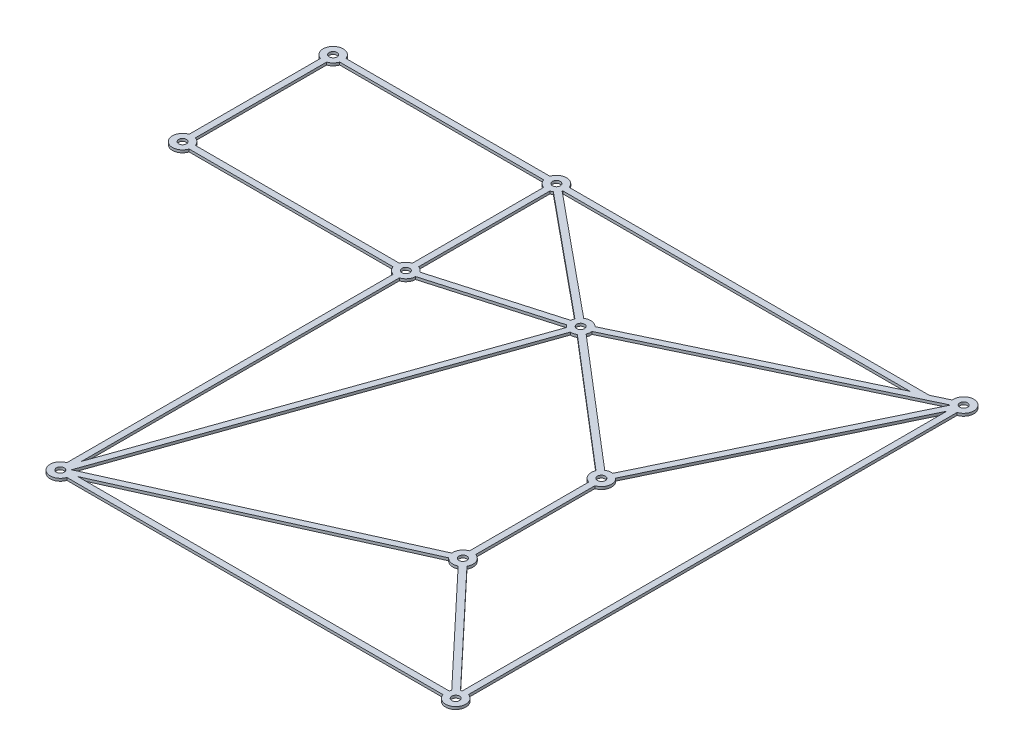
from build123d import *

# Parameters (mm, degrees)
SKETCH1_R           = 1.5000000000001341
SKETCH1_R_2         = 1.5000000000000266
SKETCH1_R_3         = 1.4999999999999927
SKETCH1_R_4         = 1.5000000000003626
SKETCH1_R_5         = 1.4999999999999407
SKETCH1_R_6         = 1.500000000000151
BOSS_EXTRUDE1_DEPTH = 20
SKETCH2_R           = 1.500000000000026
SKETCH2_R_2         = 1.5000000000000242
SKETCH2_R_3         = 1.5000000000000282
SKETCH2_R_4         = 1.4999999999999991
BOSS_EXTRUDE2_DEPTH = 4.8
SKETCH3_R           = 1.4999999999999336
SKETCH3_R_2         = 1.5000000000000355
SKETCH3_R_3         = 1.500000000000057
BOSS_EXTRUDE3_DEPTH = 5
SKETCH4_R           = 1.5000000000000266
CUT_EXTRUDE1_DEPTH  = 251.6301657821741
SKETCH5_R           = 1.5000000000000258
SKETCH5_R_2         = 1.500000000000026
SKETCH5_R_3         = 1.5000000000000289
BOSS_EXTRUDE4_DEPTH = 4.7
CUT_EXTRUDE2_START  = -1
CUT_EXTRUDE2_DEPTH  = 251.07465025366474


with BuildPart() as part:
    # Sketch1 → Boss-Extrude1 (new body)
    with BuildSketch(Plane(origin=(0, 0, 0), x_dir=(1, 0, 0), z_dir=(0, 1, 0))):
        with BuildLine():
            ThreePointArc((153.5, 0.854204936944094), (154.38321422631046, 7.862001438777041), (148.43342016008168, 4.0555293516432975))
            Line((148.4334201600817, 4.05552935164329), (55.136136135840104, -40.297999473481156))
            ThreePointArc((55.136136135840104, -40.297999473481205), (49.4022066675553, -40.36486709103945), (49.9330012537212, -46.07456721738933))
            Line((49.93300125372118, -46.07456721738933), (0.10392068340978255, -187.20138479821878))
            ThreePointArc((0.10392068340981986, -187.2013847982188), (-3.183862952537658, -193.35233583185502), (3.7107950630558904, -192.30000000000007))
            Line((3.7107950630558797, -192.30000000000007), (148.58920493694413, -192.30000000000004))
            ThreePointArc((148.58920493694416, -192.29999999999998), (155.05771644662758, -193.8577164466275), (153.5, -187.38920493694408))
            Line((153.5, -187.38920493694408), (153.50000000000006, 0.8542049369440861))
        make_face()
        with Locations(Location((-8.848e-14, -191.1000000000001, 0), (0, 0, 270))):
            Circle(SKETCH1_R, mode=Mode.SUBTRACT)
        with BuildLine():
            ThreePointArc((103.3728036004878, -88.15255576252058), (103.43263144023695, -91.28238466086896), (105.77419999999994, -93.35999506305585))
            Line((105.77420000000004, -93.35999506305582), (105.77420000000004, -139.26420493694414))
            ThreePointArc((105.77419999999995, -139.26420493694414), (103.6992799358026, -140.85724208817035), (103.09776398625954, -143.4030698907605))
            Line((103.09776398625954, -143.4030698907605), (2.065248361956577, -188.85505564451773))
            Line((2.065248361956572, -188.85505564451773), (52.196079316590236, -46.87361520178129))
            ThreePointArc((52.19607931659019, -46.873615201781234), (53.3115705172937, -46.74152692656541), (54.34314539722364, -46.296980867766095))
            Line((54.34314539722364, -46.296980867766095), (103.3728036004877, -88.15255576252065))
        make_face(mode=Mode.SUBTRACT)
        with BuildLine():
            ThreePointArc((104.08241137935872, -145.59178401354208), (106.21355041942587, -146.8001029026122), (108.64483789051103, -146.49905576556174))
            Line((108.64483789051097, -146.49905576556182), (148.88225626835828, -189.22142932397452))
            ThreePointArc((148.88225626835816, -189.22142932397455), (148.7196186128475, -189.5537564478609), (148.58920493694413, -189.90000000000006))
            Line((148.5892049369441, -189.9), (5.592313538765211, -189.9))
            Line((5.5923135387652225, -189.9), (104.08241137935869, -145.59178401354194))
        make_face(mode=Mode.SUBTRACT)
        with Locations(Location((106.97420000000002, -142.975, 0), (0, 0, 270))):
            Circle(SKETCH1_R_2, mode=Mode.SUBTRACT)
        with Locations(Location((152.3, -191.09999999999997, 0), (0, 0, 270))):
            Circle(SKETCH1_R_3, mode=Mode.SUBTRACT)
        with BuildLine():
            Line((108.17420000000006, -139.26420493694408), (108.17420000000006, -93.35999506305589))
            ThreePointArc((108.17420000000001, -93.35999506305588), (110.7765884274194, -90.51628837325106), (109.66431253714993, -86.82549772506573))
            Line((109.66431253715001, -86.82549772506573), (151.10000000000005, -0.6972849684802185))
            Line((151.10000000000005, -0.6972849684802256), (151.09999999999997, -187.38920493694414))
            ThreePointArc((151.09999999999997, -187.38920493694414), (150.861647342994, -187.47492874082678), (150.62936210948922, -187.57594423443817))
            Line((150.62936210948916, -187.57594423443825), (110.3919437316418, -144.85357067602544))
            ThreePointArc((110.39194373164192, -144.85357067602538), (110.5992712591732, -141.53664734299386), (108.17420000000001, -139.2642049369441))
        make_face(mode=Mode.SUBTRACT)
        with Locations(Location((52.29999999999968, -42.97500000000005, 0), (0, 0, 270))):
            Circle(SKETCH1_R_4, mode=Mode.SUBTRACT)
        with Locations(Location((106.9742, -89.6491999999999, 0), (0, 0, 270))):
            Circle(SKETCH1_R_5, mode=Mode.SUBTRACT)
        with BuildLine():
            Line((149.6098874628501, 1.7412977250657464), (107.501580307415, -85.78502220759042))
            ThreePointArc((107.50158030741511, -85.78502220759047), (106.16928986331158, -85.83316545195719), (104.93105460277636, -86.32721913223392))
            Line((104.93105460277634, -86.32721913223394), (55.901396399512244, -44.47164423747948))
            ThreePointArc((55.90139639951222, -44.471644237479474), (56.16636670686683, -43.48608559755858), (56.16657983991836, -42.46552935164333))
            Line((56.166579839918334, -42.4655293516433), (149.46386386415992, 1.8879994734811447))
            ThreePointArc((149.46386386415995, 1.887999473481198), (149.53590223586832, 1.8136796714446448), (149.6098874628501, 1.7412977250657597))
        make_face(mode=Mode.SUBTRACT)
        with Locations(Location((152.3000000000001, 4.5650000000001185, 0), (0, 0, 270))):
            Circle(SKETCH1_R_6, mode=Mode.SUBTRACT)
    extrude(amount=BOSS_EXTRUDE1_DEPTH)

    # Sketch2 → Boss-Extrude2 (add)
    # profile 1 of 8: a face of its own
    with BuildSketch(Plane(origin=(0, 20, 0), x_dir=(1, 0, 0), z_dir=(0, 1, 0))):
        with BuildLine():
            ThreePointArc((151.10000000000005, -187.3892049369441), (152.30000000000004, -187.2), (153.50000000000006, -187.3892049369441))
            Line((153.50000000000006, -187.3892049369441), (153.50000000000006, 0.8542049369441145))
            ThreePointArc((153.50000000000006, 0.854204936944114), (152.30000000000007, 0.6650000000000027), (151.10000000000008, 0.8542049369440972))
            Line((151.10000000000008, 0.8542049369441145), (151.10000000000008, -0.6972849684802327))
            Line((151.10000000000008, -0.6972849684802327), (151.10000000000005, -187.3892049369441))
        make_face()
    # profile 2 of 8: a face of its own
    with BuildSketch(Plane(origin=(0, 20, 0), x_dir=(1, 0, 0), z_dir=(0, 1, 0))):
        with BuildLine():
            ThreePointArc((151.10000000000008, 0.8542049369440972), (152.30000000000007, 0.6650000000000027), (153.50000000000006, 0.854204936944114))
            ThreePointArc((153.50000000000006, 0.8542049369441145), (155.45356940624433, 2.2704412188832563), (156.20000000000005, 4.5649999999999995))
            ThreePointArc((156.20000000000005, 4.5649999999999995), (152.04471719180643, 8.456635991179125), (148.4334201600817, 4.055529351643286))
            ThreePointArc((148.4334201600817, 4.055529351643285), (148.7777639479866, 2.890528980872804), (149.46386386415998, 1.887999473481146))
            ThreePointArc((149.46386386416, 1.8879994734811634), (149.53590223586832, 1.813679671444651), (149.60988746285008, 1.7412977250658015))
            ThreePointArc((149.60988746285008, 1.7412977250657988), (150.30501195702655, 1.2138773957981126), (151.10000000000008, 0.8542049369440972))
        make_face()
        with Locations(Location((152.30000000000004, 4.5649999999999995, 0), (0, 0, 270))):
            Circle(SKETCH2_R, mode=Mode.SUBTRACT)
    # profile 3 of 8: a face of its own
    with BuildSketch(Plane(origin=(0, 20, 0), x_dir=(1, 0, 0), z_dir=(0, 1, 0))):
        with BuildLine():
            ThreePointArc((156.20000000000005, -191.1), (155.45356940624436, -188.80544121888326), (153.50000000000006, -187.3892049369441))
            ThreePointArc((153.50000000000006, -187.3892049369441), (152.30000000000004, -187.2), (151.10000000000005, -187.3892049369441))
            ThreePointArc((151.10000000000005, -187.3892049369441), (150.861647342994, -187.47492874082678), (150.62936210948916, -187.5759442344382))
            ThreePointArc((150.62936210948916, -187.5759442344382), (149.62608672950364, -188.2609530081622), (148.88225626835825, -189.22142932397443))
            ThreePointArc((148.88225626835825, -189.22142932397443), (148.71961861284757, -189.55375644786082), (148.58920493694416, -189.9))
            ThreePointArc((148.58920493694416, -189.9), (148.40000000000003, -191.10000000000002), (148.58920493694416, -192.30000000000004))
            ThreePointArc((148.58920493694416, -192.30000000000004), (152.90741223813905, -194.95240838605656), (156.20000000000005, -191.1))
        make_face()
        with Locations(Location((152.30000000000004, -191.1, 0), (0, 0, 270))):
            Circle(SKETCH2_R_2, mode=Mode.SUBTRACT)
    # profile 4 of 8: a face of its own
    with BuildSketch(Plane(origin=(0, 20, 0), x_dir=(1, 0, 0), z_dir=(0, 1, 0))):
        with BuildLine():
            ThreePointArc((108.17420000000006, -93.35999506305586), (106.97420000000004, -93.54919999999997), (105.77420000000002, -93.35999506305588))
            Line((105.77420000000004, -93.35999506305588), (105.77420000000004, -139.2642049369441))
            ThreePointArc((105.77420000000002, -139.2642049369441), (106.97420000000004, -139.075), (108.17420000000006, -139.2642049369441))
            Line((108.17420000000006, -139.2642049369441), (108.17420000000006, -93.35999506305586))
        make_face()
    # profile 5 of 8: a face of its own
    with BuildSketch(Plane(origin=(0, 20, 0), x_dir=(1, 0, 0), z_dir=(0, 1, 0))):
        with BuildLine():
            ThreePointArc((108.17420000000006, -139.2642049369441), (106.97420000000004, -139.075), (105.77420000000002, -139.2642049369441))
            ThreePointArc((105.77420000000002, -139.2642049369441), (103.69927993580262, -140.85724208817032), (103.09776398625954, -143.4030698907605))
            ThreePointArc((103.09776398625954, -143.4030698907605), (103.4175395504801, -144.575052013786), (104.08241137935862, -145.59178401354197))
            ThreePointArc((104.08241137935862, -145.59178401354197), (106.21355041942574, -146.80010290261217), (108.64483789051093, -146.49905576556176))
            ThreePointArc((108.64483789051093, -146.49905576556176), (109.64811327049645, -145.81404699183776), (110.39194373164183, -144.85357067602556))
            ThreePointArc((110.3919437316418, -144.85357067602553), (110.75171244560511, -143.94474209112445), (110.8742, -142.975))
            ThreePointArc((110.8742, -142.975), (110.12776940624433, -140.68044121888326), (108.17420000000006, -139.2642049369441))
        make_face()
        with Locations(Location((106.97420000000002, -142.975, 0), (0, 0, 270))):
            Circle(SKETCH2_R_2, mode=Mode.SUBTRACT)
    # profile 6 of 8: a face of its own
    with BuildSketch(Plane(origin=(0, 20, 0), x_dir=(1, 0, 0), z_dir=(0, 1, 0))):
        with BuildLine():
            ThreePointArc((103.37280360048776, -88.15255576252066), (103.43263144023699, -91.28238466086904), (105.77420000000002, -93.35999506305588))
            ThreePointArc((105.77420000000002, -93.35999506305588), (106.97420000000004, -93.54919999999997), (108.17420000000006, -93.35999506305586))
            ThreePointArc((108.17420000000006, -93.35999506305586), (110.12776940624433, -91.94375878111673), (110.87420000000002, -89.64919999999998))
            ThreePointArc((110.87420000000002, -89.64919999999998), (110.55899001441402, -88.11320502847254), (109.66431253714997, -86.82549772506577))
            ThreePointArc((109.66431253714997, -86.82549772506577), (108.6649727158974, -86.13476012668062), (107.50158030741501, -85.78502220759047))
            ThreePointArc((107.50158030741501, -85.78502220759047), (106.16928986331155, -85.8331654519572), (104.93105460277637, -86.32721913223392))
            ThreePointArc((104.93105460277637, -86.32721913223392), (104.00802797578407, -87.117042121281), (103.37280360048776, -88.15255576252066))
        make_face()
        with Locations(Location((106.97420000000002, -89.64919999999998, 0), (0, 0, 270))):
            Circle(SKETCH2_R_3, mode=Mode.SUBTRACT)
    # profile 7 of 8: a face of its own
    with BuildSketch(Plane(origin=(0, 20, 0), x_dir=(1, 0, 0), z_dir=(0, 1, 0))):
        with BuildLine():
            ThreePointArc((3.9000000000000385, -191.10000000000002), (3.639229013163515, -189.69785443346666), (2.8917886206414805, -188.48321598645808))
            Line((2.8917886206414494, -188.48321598645805), (2.0652483619565345, -188.85505564451776))
            Line((2.0652483619565296, -188.85505564451776), (2.3669987462788447, -188.00043278261063))
            ThreePointArc((2.3669987462787443, -188.00043278261063), (1.2984529746368263, -187.42249814783776), (0.10392068340977106, -187.20138479821878))
            ThreePointArc((0.10392068340977109, -187.20138479821878), (-3.1838629525376483, -193.35233583185502), (3.71079506305589, -192.30000000000004))
            ThreePointArc((3.710795063055924, -192.30000000000004), (3.8524083860566067, -191.70741223813903), (3.9000000000000385, -191.10000000000002))
        make_face()
        with Locations(Location((2.776e-14, -191.10000000000002, 0), (0, 0, 270))):
            Circle(SKETCH2_R_4, mode=Mode.SUBTRACT)
    # profile 8 of 8: a face of its own
    with BuildSketch(Plane(origin=(0, 20, 0), x_dir=(1, 0, 0), z_dir=(0, 1, 0))):
        with BuildLine():
            ThreePointArc((49.93300125372118, -46.07456721738931), (51.00154702536313, -46.652501852162246), (52.19607931659024, -46.873615201781234))
            ThreePointArc((52.19607931659024, -46.873615201781234), (53.311570517293724, -46.741526926565406), (54.34314539722362, -46.29698086776611))
            ThreePointArc((54.34314539722362, -46.29698086776611), (55.266172024215926, -45.50715787871904), (55.90139639951226, -44.47164423747939))
            ThreePointArc((55.90139639951226, -44.47164423747939), (56.124620632043, -43.738070783709574), (56.20000000000001, -42.975000000000016))
            ThreePointArc((56.20000000000001, -42.975000000000016), (56.19163599117914, -42.71971719180637), (56.16657983991835, -42.46552935164326))
            ThreePointArc((56.16657983991835, -42.46552935164326), (55.82223605201343, -41.300528980872805), (55.136136135840076, -40.29799947348117))
            ThreePointArc((55.136136135840076, -40.29799947348116), (49.40220666755529, -40.36486709103945), (49.93300125372118, -46.07456721738931))
        make_face()
        with Locations(Location((52.30000000000001, -42.975000000000016, 0), (0, 0, 270))):
            Circle(SKETCH2_R, mode=Mode.SUBTRACT)
    extrude(amount=BOSS_EXTRUDE2_DEPTH)



with BuildPart() as body_2:
    # Sketch3 → Boss-Extrude3 (new body)
    with BuildSketch(Plane.XZ):
        with BuildLine():
            Line((137.37845728325527, 1.200000000000005), (3.71079506305594, 1.199999999999998))
            ThreePointArc((3.710795063055913, 1.1999999999999462), (3.6716203346799547, 1.3149920600386407), (3.628883136841208, 1.4287082204388433))
            Line((3.628883136841213, 1.4287082204388344), (50.19479389277008, 39.691997221127956))
            ThreePointArc((50.19479389277007, 39.69199722112795), (49.28677134254604, 40.499024826881744), (48.67111686315881, 41.546291779561194))
            Line((48.67111686315881, 41.546291779561194), (2.105206107229961, 3.2830027788720457))
            ThreePointArc((2.105206107229945, 3.283002778872073), (1.6663878337347684, 3.526067439454435), (1.19999999999995, 3.7107950630559117))
            Line((1.2000000000000008, 3.710795063055926), (1.1999999999999664, 54.289204936944074))
            ThreePointArc((1.1999999999999607, 54.28920493694409), (2.346302264669601, 54.88473665915603), (3.2351951302831314, 55.82203937845692))
            Line((3.2351951302831328, 55.822039378457), (48.402125364294776, 42.84626257604746))
            ThreePointArc((48.402125364294804, 42.84626257604746), (48.55161567606957, 44.051854196310934), (49.06480486971691, 45.15296062154312))
            Line((49.06480486971694, 45.152960621543), (3.89787463570525, 58.12873742395266))
            ThreePointArc((3.897874635705213, 58.1287374239526), (3.1152633408439394, 60.34630226466963), (1.1999999999999666, 61.710795063055905))
            Line((1.2000000000000157, 61.71079506305591), (1.200000000000001, 184.09704925768483))
            Line((1.199999999999998, 184.09704925768483), (0.10392068340978255, 187.20138479821878))
            ThreePointArc((0.10392068340981803, 187.2013847982188), (-0.55602748870172, 187.2398402323469), (-1.2000000000000701, 187.38920493694417))
            Line((-1.2000000000000595, 187.3892049369442), (-1.1999999999999875, 61.710795063055855))
            ThreePointArc((-1.200000000000067, 61.710795063055876), (-2.7577164466275903, 60.757716446627484), (-3.7107950630559223, 59.199999999999925))
            Line((-3.71079506305594, 59.19999999999993), (-82.28920493694406, 59.19999999999996))
            ThreePointArc((-82.28920493694409, 59.19999999999991), (-88.75771644662751, 60.75771644662754), (-87.19999999999999, 54.28920493694409))
            Line((-87.19999999999999, 54.28920493694409), (-87.2, 3.7107950630558975))
            ThreePointArc((-87.19999999999999, 3.710795063055896), (-88.75771644662751, -2.75771644662756), (-82.28920493694409, -1.1999999999999194))
            Line((-82.28920493694406, -1.1999999999999253), (-3.71079506305594, -1.199999999999997))
            ThreePointArc((-3.7107950630559174, -1.199999999999933), (-7.64e-15, -3.9000000000000012), (3.710795063055914, -1.1999999999999442))
            Line((3.7107950630559285, -1.2), (142.42683759457205, -1.2))
            Line((142.42683759457205, -1.1999999999999886), (137.37845728325527, 1.20000000000001))
        make_face()
        with Locations(Location((-86.00000000000006, -7.722e-14, 0), (0, 0, 270))):
            Circle(SKETCH3_R, mode=Mode.SUBTRACT)
        with Locations(Location((-7.05e-15, -6.72e-15, 0), (0, 0, 270))):
            Circle(SKETCH3_R_2, mode=Mode.SUBTRACT)
        with BuildLine():
            Line((-3.71079506305594, 1.2), (-82.28920493694409, 1.2))
            ThreePointArc((-82.2892049369441, 1.1999999999999682), (-83.24228355337245, 2.7577164466275095), (-84.79999999999997, 3.710795063055881))
            Line((-84.79999999999998, 3.710795063055878), (-84.79999999999997, 54.28920493694411))
            ThreePointArc((-84.79999999999997, 54.2892049369441), (-83.24228355337245, 55.242283553372474), (-82.2892049369441, 56.80000000000002))
            Line((-82.28920493694409, 56.79999999999999), (-3.71079506305594, 56.79999999999999))
            ThreePointArc((-3.710795063055918, 56.80000000000006), (-2.757716446627586, 55.24228355337251), (-1.200000000000069, 54.289204936944124))
            Line((-1.2000000000000624, 54.289204936944145), (-1.200000000000004, 3.7107950630558477))
            ThreePointArc((-1.200000000000083, 3.710795063055869), (-2.757716446627592, 2.75771644662748), (-3.7107950630559174, 1.1999999999999338))
        make_face(mode=Mode.SUBTRACT)
        with Locations(Location((-85.99999999999996, 57.999999999999986, 0), (0, 0, 270))):
            Circle(SKETCH3_R_3, mode=Mode.SUBTRACT)
    extrude(amount=-BOSS_EXTRUDE3_DEPTH)

    # Sketch4 → Cut-Extrude1 (cut, through all)
    with BuildSketch(Plane(origin=(0, 5, 0), x_dir=(1, 0, 0), z_dir=(0, 1, 0))):
        with Locations(Location((-1.84e-15, -58, 0), (0, 0, 270))):
            Circle(SKETCH4_R)
    extrude(amount=-CUT_EXTRUDE1_DEPTH, mode=Mode.SUBTRACT)


with BuildPart() as part_1:
    add(part.part)

    add(body_2.part)  # Boss-Extrude4 merges body 2
    # Sketch5 → Boss-Extrude4 (add)
    # profile 1 of 4: a face of its own
    with BuildSketch(Plane(origin=(0, 5, 0), x_dir=(1, 0, 0), z_dir=(0, 1, 0))):
        with BuildLine():
            ThreePointArc((-82.10000000000001, 0), (-82.14759161394343, 0.6074122381389802), (-82.2892049369441, 1.199999999999999))
            ThreePointArc((-82.28920493694412, 1.1999999999999962), (-88.75771644662755, 2.7577164466275432), (-87.2, -3.710795063055894))
            ThreePointArc((-87.2, -3.7107950630558917), (-86, -3.8999999999999977), (-84.79999999999998, -3.7107950630558877))
            ThreePointArc((-84.79999999999998, -3.710795063055892), (-83.24228355337246, -2.7577164466275286), (-82.2892049369441, -1.1999999999999988))
            ThreePointArc((-82.2892049369441, -1.199999999999999), (-82.14759161394343, -0.6074122381389806), (-82.10000000000001, -9.6e-16))
        make_face()
        with Locations(Location((-86, 0, 0), (0, 0, 90))):
            Circle(SKETCH5_R, mode=Mode.SUBTRACT)
    # profile 2 of 4: a face of its own
    with BuildSketch(Plane(origin=(0, 5, 0), x_dir=(1, 0, 0), z_dir=(0, 1, 0))):
        with BuildLine():
            ThreePointArc((-84.79999999999998, -54.2892049369441), (-86, -54.09999999999999), (-87.2, -54.289204936944095))
            ThreePointArc((-87.2, -54.28920493694411), (-88.75771644662751, -60.75771644662753), (-82.28920493694409, -59.199999999999996))
            ThreePointArc((-82.2892049369441, -59.19999999999999), (-82.14759161394343, -58.60741223813897), (-82.10000000000001, -57.999999999999986))
            ThreePointArc((-82.10000000000001, -57.999999999999986), (-82.14759161394343, -57.39258776186101), (-82.2892049369441, -56.79999999999999))
            ThreePointArc((-82.2892049369441, -56.79999999999999), (-83.24228355337246, -55.24228355337246), (-84.79999999999998, -54.2892049369441))
        make_face()
        with Locations(Location((-86, -57.999999999999986, 0), (0, 0, 90))):
            Circle(SKETCH5_R_2, mode=Mode.SUBTRACT)
    # profile 3 of 4: a face of its own
    with BuildSketch(Plane(origin=(0, 5, 0), x_dir=(1, 0, 0), z_dir=(0, 1, 0))):
        with BuildLine():
            ThreePointArc((-3.7107950630558952, -56.79999999999999), (-3.9000000000000044, -57.999999999999986), (-3.7107950630559032, -59.19999999999999))
            ThreePointArc((-3.7107950630559037, -59.19999999999999), (-2.757716446627537, -60.75771644662754), (-1.199999999999984, -61.710795063055905))
            ThreePointArc((-1.1999999999999855, -61.710795063055905), (1.823e-14, -61.900000000000006), (1.200000000000017, -61.71079506305589))
            ThreePointArc((1.200000000000016, -61.71079506305589), (3.115263340843935, -60.346302264669646), (3.89787463570521, -58.12873742395267))
            ThreePointArc((3.8978746357052114, -58.12873742395267), (3.899468622726072, -58.064377483445995), (3.900000000000001, -58))
            ThreePointArc((3.900000000000001, -58), (3.730097921509862, -56.86141776935181), (3.235195130283174, -55.822039378456985))
            ThreePointArc((3.23519513028317, -55.822039378456985), (2.3463022646696547, -54.884736659156076), (1.200000000000015, -54.28920493694412))
            ThreePointArc((1.200000000000018, -54.28920493694411), (1.658e-14, -54.099999999999994), (-1.1999999999999864, -54.289204936944095))
            ThreePointArc((-1.199999999999985, -54.2892049369441), (-2.757716446627525, -55.24228355337246), (-3.710795063055893, -56.79999999999999))
        make_face()
        with Locations(Location((-1.84e-15, -58, 0), (0, 0, 270))):
            Circle(SKETCH5_R_3, mode=Mode.SUBTRACT)
    # profile 4 of 4: a face of its own
    with BuildSketch(Plane(origin=(0, 5, 0), x_dir=(1, 0, 0), z_dir=(0, 1, 0))):
        with BuildLine():
            ThreePointArc((-3.7107950630558957, 1.2000000000000015), (-3.9000000000000017, 4.8e-16), (-3.7107950630558966, -1.1999999999999988))
            ThreePointArc((-3.7107950630558957, -1.1999999999999997), (-2.7577164466275357, -2.7577164466275366), (-1.1999999999999984, -3.710795063055896))
            ThreePointArc((-1.2, -3.710795063055896), (-7.2e-16, -3.9000000000000017), (1.1999999999999986, -3.7107950630558966))
            ThreePointArc((1.2000000000000013, -3.7107950630558957), (1.6663878337348053, -3.526067439454418), (2.105206107229968, -3.28300277887206))
            ThreePointArc((2.1052061072299666, -3.283002778872059), (3.0132286574539884, -2.47597517311827), (3.6288831368412127, -1.4287082204388324))
            ThreePointArc((3.6288831368412136, -1.4287082204388306), (3.671620334679948, -1.3149920600386606), (3.710795063055896, -1.2000000000000002))
            ThreePointArc((3.710795063055896, -1.2000000000000004), (3.8524083860565725, -0.6074122381389813), (3.9000000000000017, -9.6e-16))
            ThreePointArc((3.9000000000000017, 0), (3.8524083860565725, 0.6074122381389807), (3.710795063055896, 1.2000000000000002))
            ThreePointArc((3.7107950630558957, 1.2), (5.6e-16, 3.9000000000000012), (-3.7107950630558952, 1.2000000000000006))
        make_face()
        with Locations(Location((0, 0, 0), (0, 0, 90))):
            Circle(SKETCH5_R_2, mode=Mode.SUBTRACT)
    extrude(amount=BOSS_EXTRUDE4_DEPTH)

    # Sketch6 → Cut-Extrude2 (cut, through all)
    with BuildSketch(Plane.XZ.offset(CUT_EXTRUDE2_START)):
        with BuildLine():
            Line((3.7107950630558957, -1.2), (142.42683759457205, -1.1999999999999997))
            Line((142.42683759457205, -1.1999999999999997), (148.4334201600817, -4.055529351643287))
            ThreePointArc((148.4334201600817, -4.055529351643287), (154.3832142263104, -7.86200143877705), (153.50000000000006, -0.8542049369441143))
            Line((153.50000000000006, -0.8542049369441143), (153.50000000000006, 187.3892049369441))
            ThreePointArc((153.50000000000006, 187.3892049369441), (155.05771644662758, 193.8577164466275), (148.58920493694416, 192.30000000000004))
            Line((148.58920493694416, 192.30000000000004), (3.7107950630559037, 192.30000000000004))
            ThreePointArc((3.7107950630559037, 192.30000000000004), (-2.757716446627498, 193.85771644662756), (-1.199999999999992, 187.38920493694414))
            Line((-1.199999999999992, 187.38920493694414), (-1.1999999999999837, 61.710795063055905))
            ThreePointArc((-1.1999999999999837, 61.710795063055905), (-2.757716446627537, 60.75771644662754), (-3.7107950630559032, 59.19999999999999))
            Line((-3.7107950630559032, 59.19999999999999), (-82.2892049369441, 59.19999999999999))
            ThreePointArc((-82.2892049369441, 59.19999999999999), (-88.75771644662754, 60.757716446627526), (-87.2, 54.2892049369441))
            Line((-87.2, 54.2892049369441), (-87.2, 3.7107950630558904))
            ThreePointArc((-87.2, 3.7107950630558904), (-88.75771644662753, -2.757716446627534), (-82.2892049369441, -1.2))
            Line((-82.2892049369441, -1.2), (-3.7107950630558957, -1.2))
            ThreePointArc((-3.7107950630558957, -1.2), (2.4e-16, -3.9000000000000012), (3.7107950630558957, -1.2))
        make_face()
    extrude(amount=-CUT_EXTRUDE2_DEPTH, mode=Mode.SUBTRACT)


solid = part_1.part
